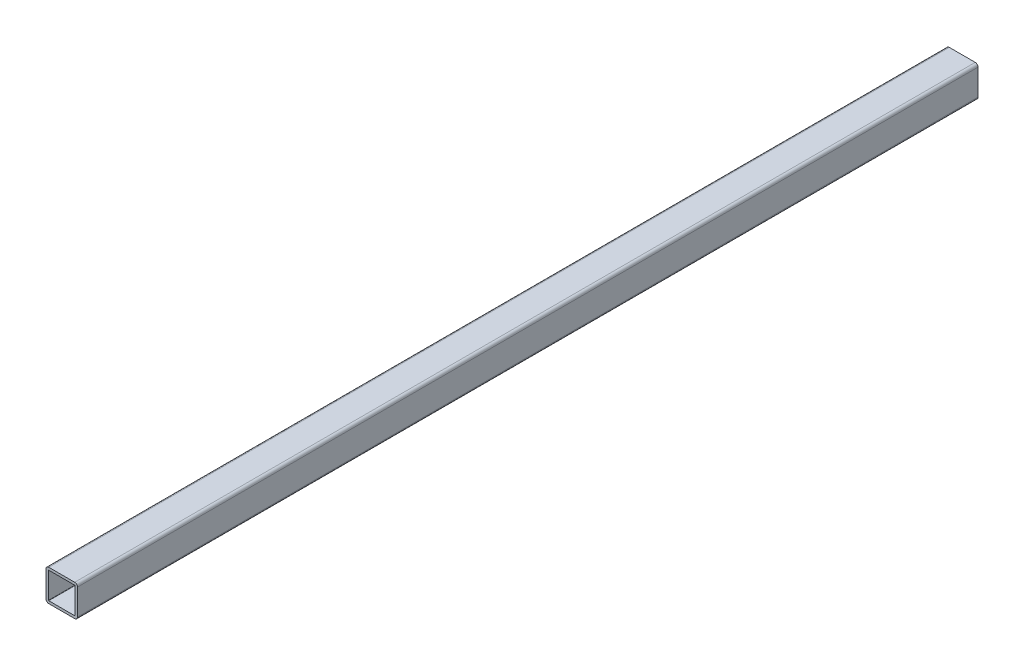
from build123d import *

# Parameters (mm, degrees)
STRUCTURAL_MEMBER1_DEPTH = 715


with BuildPart() as part:
    # Sketch11 → Structural Member1 (new body)
    with BuildSketch(Plane(origin=(0, 0, 0), x_dir=(-1, 0, 0), z_dir=(0, 0, -1))):
        with BuildLine():
            Line((-10.3, -12.5), (10.3, -12.5))
            ThreePointArc((10.3, -12.5), (11.855634919, -11.855634919), (12.5, -10.3))
            Line((12.5, -10.3), (12.5, 10.3))
            ThreePointArc((12.5, 10.3), (11.855634919, 11.855634919), (10.3, 12.5))
            Line((10.3, 12.5), (-10.3, 12.5))
            ThreePointArc((-10.3, 12.5), (-11.855634919, 11.855634919), (-12.5, 10.3))
            Line((-12.5, 10.3), (-12.5, -10.3))
            ThreePointArc((-12.5, -10.3), (-11.855634919, -11.855634919), (-10.3, -12.5))
        make_face()
        with BuildLine():
            Line((-10.3, -10.5), (10.3, -10.5))
            ThreePointArc((10.3, -10.5), (10.441421356, -10.441421356), (10.5, -10.3))
            Line((10.5, -10.3), (10.5, 10.3))
            ThreePointArc((10.5, 10.3), (10.441421356, 10.441421356), (10.3, 10.5))
            Line((10.3, 10.5), (-10.3, 10.5))
            ThreePointArc((-10.3, 10.5), (-10.441421356, 10.441421356), (-10.5, 10.3))
            Line((-10.5, 10.3), (-10.5, -10.3))
            ThreePointArc((-10.5, -10.3), (-10.441421356, -10.441421356), (-10.3, -10.5))
        make_face(mode=Mode.SUBTRACT)
    extrude(amount=STRUCTURAL_MEMBER1_DEPTH)


solid = part.part
